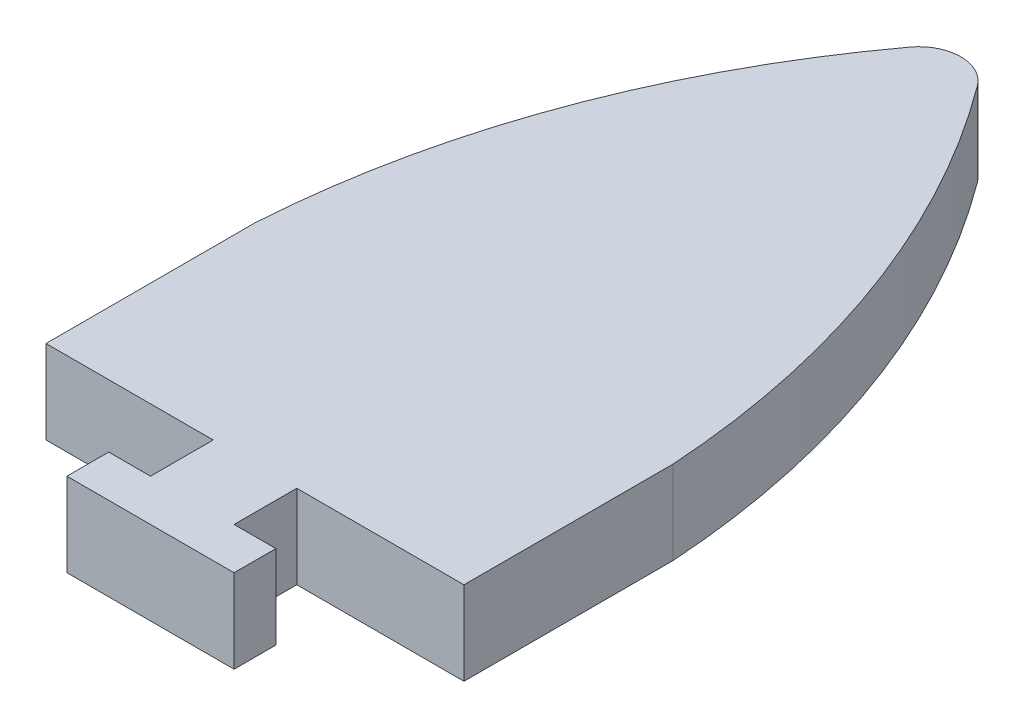
from build123d import *

# Parameters (mm, degrees)
EXTRUDE_1_DEPTH = 4


with BuildPart() as part:
    # Эскиз1 → Бобышка-Вытянуть1 (new body)
    with BuildSketch(Plane(origin=(0, 0, 0), x_dir=(1, 0, 0), z_dir=(0, 1, 0))):
        with BuildLine():
            Line((10, -17.5), (2, -17.5))
            Line((2, -17.5), (2, -20.5))
            Line((2, -20.5), (4, -20.5))
            Line((4, -20.5), (4, -22.5))
            Line((4, -22.5), (-4, -22.5))
            Line((-4, -22.5), (-4, -20.5))
            Line((-4, -20.5), (-2, -20.5))
            Line((-2, -20.5), (-2, -17.5))
            Line((-2, -17.5), (-10, -17.5))
            Line((-10, -17.5), (-10, -7.5))
            ThreePointArc((-10, -7.5), (-7.461085915, 4.585557713), (-1.607525862, 15.459500175))
            ThreePointArc((-1.607525862, 15.459500175), (0, 16.269600766), (1.607525862, 15.459500175))
            ThreePointArc((1.607525862, 15.459500175), (7.461085915, 4.585557713), (10, -7.5))
            Line((10, -7.5), (10, -17.5))
        make_face()
    extrude(amount=EXTRUDE_1_DEPTH)


solid = part.part
